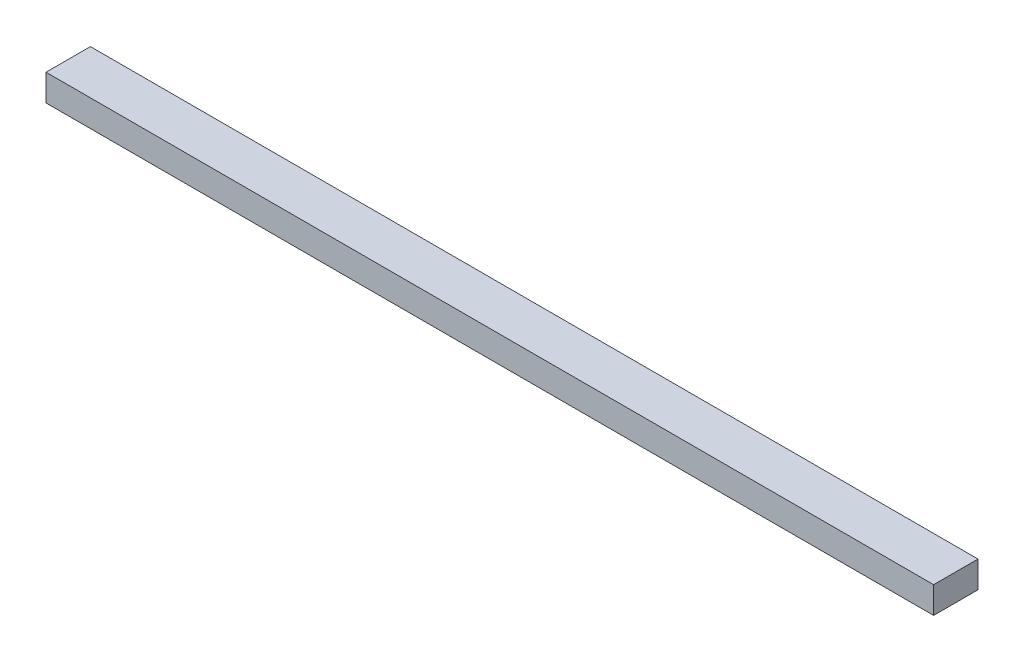
from build123d import *

# Parameters (mm, degrees)
SKETCH1_W           = 100
SKETCH1_H           = 5
BOSS_EXTRUDE1_DEPTH = 3


with BuildPart() as part:
    # Sketch1 → Boss-Extrude1 (new body)
    with BuildSketch(Plane(origin=(0, 0, 0), x_dir=(1, 0, 0), z_dir=(0, 1, 0))):
        with Locations((50, 2.5)):
            Rectangle(SKETCH1_W, SKETCH1_H)
    extrude(amount=BOSS_EXTRUDE1_DEPTH)


solid = part.part
